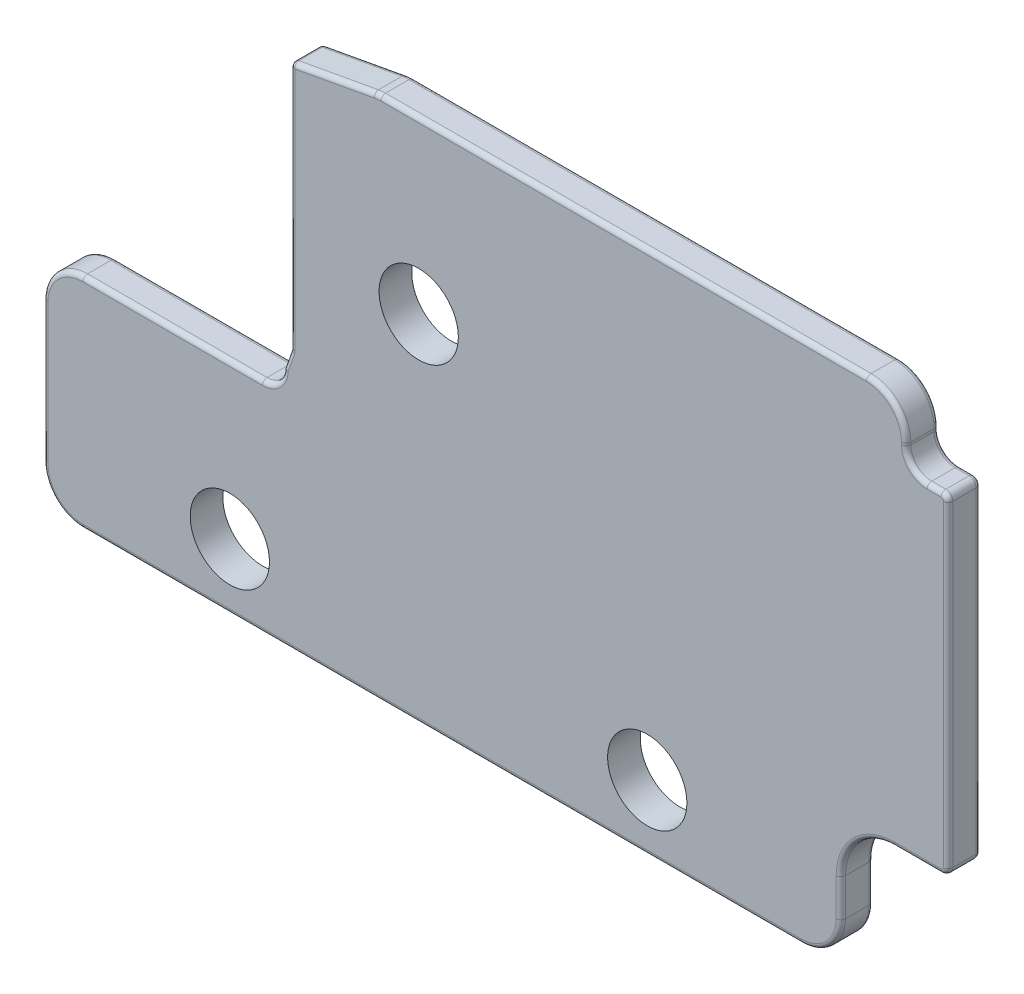
from build123d import *

# Parameters (mm, degrees)
SKETCH1_R           = 1.7
BOSS_EXTRUDE1_DEPTH = 1.4
FILLET1_R           = 0.2


with BuildPart() as part:
    # Sketch1 → Boss-Extrude1 (new body)
    with BuildSketch(Plane.XY):
        with BuildLine():
            Line((88.2, 306.15), (88.5, 306.997300304))
            Line((88.5, 306.997300304), (88.5, 317.666666667))
            Line((88.5, 317.666666667), (92.075260805, 318.322131148))
            ThreePointArc((92.075260805, 318.322131148), (92.227907414, 318.343018451), (92.381818182, 318.35))
            Line((92.381818182, 318.35), (113.2, 318.35))
            ThreePointArc((113.2, 318.35), (114.402081528, 317.852081528), (114.9, 316.65))
            Line((114.9, 316.65), (114.9, 316.55))
            ThreePointArc((114.9, 316.55), (115.163603897, 315.913603897), (115.8, 315.65))
            Line((115.8, 315.65), (116.4, 315.65))
            ThreePointArc((116.4, 315.65), (116.612132034, 315.562132034), (116.7, 315.35))
            Line((116.7, 315.35), (116.7, 301.75))
            ThreePointArc((116.7, 301.75), (116.612132034, 301.537867966), (116.4, 301.45))
            Line((116.4, 301.45), (114.4, 301.45))
            ThreePointArc((114.4, 301.45), (112.773654403, 300.776345597), (112.1, 299.15))
            Line((112.1, 299.15), (112.1, 297.55))
            ThreePointArc((112.1, 297.55), (111.602081528, 296.347918472), (110.4, 295.85))
            Line((110.4, 295.85), (79.6, 295.85))
            ThreePointArc((79.6, 295.85), (78.397918472, 296.347918472), (77.9, 297.55))
            Line((77.9, 297.55), (77.9, 303.55))
            ThreePointArc((77.9, 303.55), (78.397918472, 304.752081528), (79.6, 305.25))
            Line((79.6, 305.25), (87.3, 305.25))
            ThreePointArc((87.3, 305.25), (87.936396103, 305.513603897), (88.2, 306.15))
        make_face()
        with Locations((85.9, 298.65)):
            Circle(SKETCH1_R, mode=Mode.SUBTRACT)
        with Locations((103.8, 298.65)):
            Circle(SKETCH1_R, mode=Mode.SUBTRACT)
        with Locations((94, 311.05)):
            Circle(SKETCH1_R, mode=Mode.SUBTRACT)
    extrude(amount=BOSS_EXTRUDE1_DEPTH)

    # Fillet1
    fillet1_edges = [part.edges().sort_by_distance(p)[0] for p in [
        (88.35, 306.573650152, 1.4),
        (87.936396103, 305.513603897, 1.4),
        (83.45, 305.25, 1.4),
        (92.227907414, 318.343018451, 0),
        (102.790909091, 318.35, 0),
        (114.402081528, 317.852081528, 0),
        (114.9, 316.6, 0),
        (115.163603897, 315.913603897, 0),
        (116.1, 315.65, 0),
        (116.612132034, 315.562132034, 0),
        (116.7, 308.55, 0),
        (116.612132034, 301.537867966, 0),
        (115.4, 301.45, 0),
        (78.397918472, 304.752081528, 1.4),
        (112.773654403, 300.776345597, 0),
        (112.1, 298.35, 0),
        (111.602081528, 296.347918472, 0),
        (95, 295.85, 0),
        (78.397918472, 296.347918472, 0),
        (77.9, 300.55, 0),
        (78.397918472, 304.752081528, 0),
        (83.45, 305.25, 0),
        (87.936396103, 305.513603897, 0),
        (88.35, 306.573650152, 0),
        (77.9, 300.55, 1.4),
        (88.5, 312.331983485, 0),
        (90.287630402, 317.994398907, 0),
        (78.397918472, 296.347918472, 1.4),
        (95, 295.85, 1.4),
        (88.5, 306.997300304, 0.7),
        (88.5, 317.666666667, 0.7),
        (111.602081528, 296.347918472, 1.4),
        (112.1, 298.35, 1.4),
        (112.773654403, 300.776345597, 1.4),
        (90.287630402, 317.994398907, 1.4),
        (115.4, 301.45, 1.4),
        (116.612132034, 301.537867966, 1.4),
        (116.7, 308.55, 1.4),
        (116.612132034, 315.562132034, 1.4),
        (116.1, 315.65, 1.4),
        (115.163603897, 315.913603897, 1.4),
        (114.9, 316.6, 1.4),
        (114.402081528, 317.852081528, 1.4),
        (102.790909091, 318.35, 1.4),
        (92.227907414, 318.343018451, 1.4),
        (88.5, 312.331983485, 1.4),
    ]]
    fillet(fillet1_edges, radius=FILLET1_R)


solid = part.part
